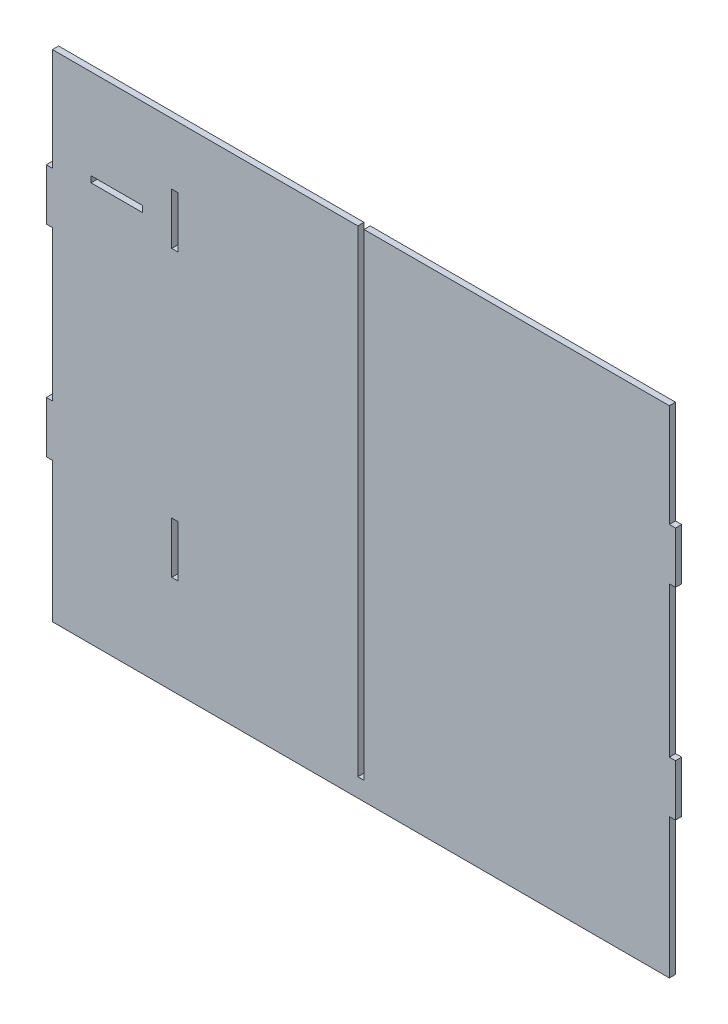
from build123d import *

# Parameters (mm, degrees)
SKETCH1_W           = 6
SKETCH1_H           = 50
SKETCH1_W_2         = 50
SKETCH1_H_2         = 6
BOSS_EXTRUDE1_DEPTH = 6


with BuildPart() as part:
    # Sketch1 → Boss-Extrude1 (new body)
    with BuildSketch(Plane.XY):
        Polygon((0, 0), (297, 0), (297, -464), (303, -464), (303, 0), (600, 0), (600, -100), (606, -100), (606, -150), (600, -150), (600, -296), (606, -296), (606, -346), (600, -346), (600, -482), (0, -482), (0, -346), (-6, -346), (-6, -296), (0, -296), (0, -150), (-6, -150), (-6, -100), (0, -100), align=None)
        with Locations((119, -361.5)):
            Rectangle(SKETCH1_W, SKETCH1_H, mode=Mode.SUBTRACT)
        with Locations((119, -84.5)):
            Rectangle(SKETCH1_W, SKETCH1_H, mode=Mode.SUBTRACT)
        with Locations((62.5, -90.5)):
            Rectangle(SKETCH1_W_2, SKETCH1_H_2, mode=Mode.SUBTRACT)
    extrude(amount=BOSS_EXTRUDE1_DEPTH)


solid = part.part
